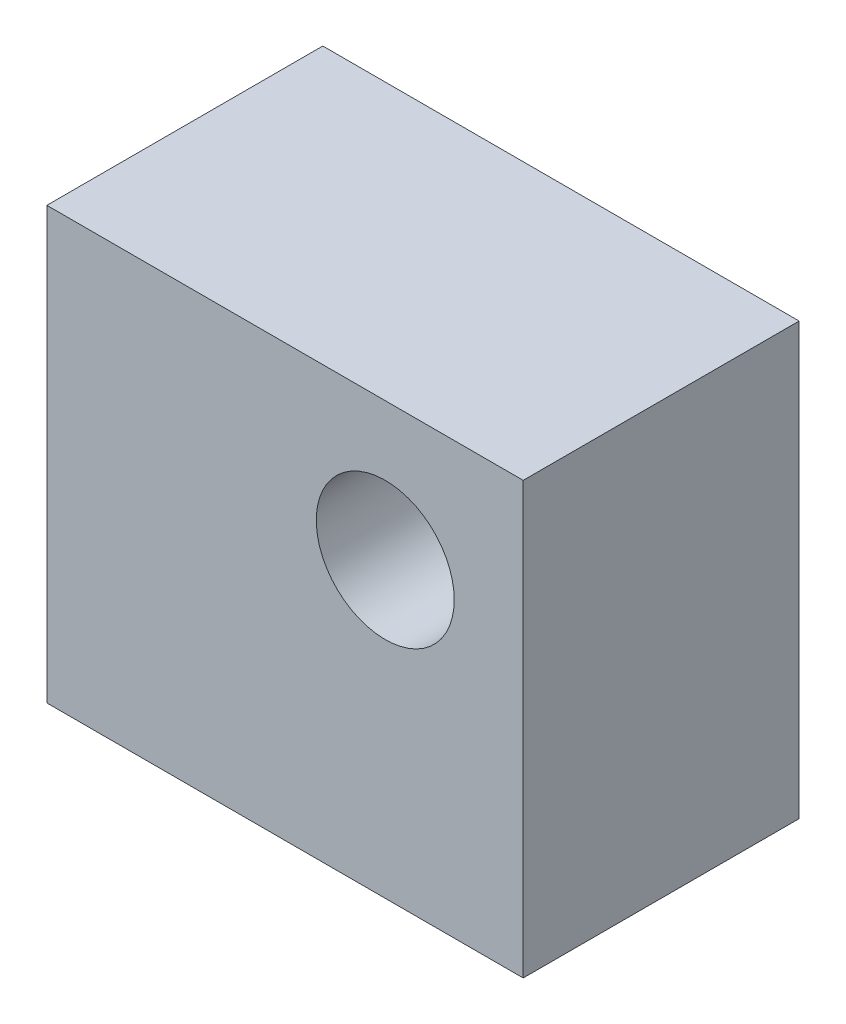
from build123d import *

# Parameters (mm, degrees)
SKETCH3_W                      = 21.924187445
SKETCH3_H                      = 19.837641971
BOSS_EXTRUDE1_DEPTH            = 6.35
SKETCH4_R                      = 3.175
CUT_EXTRUDE1_DEPTH             = 9.525
SKETCH5_R                      = 3.175
CUT_EXTRUDE5_DEPTH             = 9.525
CUT_EXTRUDE5_DIRECTION_2_REACH = 27.174
SKETCH6_R                      = 3.175
CUT_EXTRUDE6_DEPTH             = 9.525


with BuildPart() as part:
    # Sketch3 → Boss-Extrude1 (new, symmetric)
    with BuildSketch(Plane.XY):
        with Locations((10.962093723, -9.918820986)):
            Rectangle(SKETCH3_W, SKETCH3_H)
    extrude(amount=BOSS_EXTRUDE1_DEPTH, both=True)

    # Sketch4 → Cut-Extrude1 (cut)
    with BuildSketch(Plane.ZY):
        with Locations(Location((0, -6.35, 0), (0, 0, 270))):
            Circle(SKETCH4_R)
    extrude(amount=-CUT_EXTRUDE1_DEPTH, mode=Mode.SUBTRACT)

    # Sketch5 → Cut-Extrude5 (cut)
    with BuildSketch(Plane(origin=(7.787093723, -19.837641971, 0), x_dir=(-0.8660254037844382, 0.500000000000001, 0), z_dir=(-0.500000000000001, -0.8660254037844382, 0))):
        with Locations(Location((0, 0, 0), (0, 0, 180))):
            Circle(SKETCH5_R)
    extrude(amount=-CUT_EXTRUDE5_DEPTH, mode=Mode.SUBTRACT)

    # Sketch5 → Cut-Extrude5 direction 2 (cut, up to next)
    with BuildSketch(Plane(origin=(7.787093723, -19.837641971, 0), x_dir=(-0.8660254037844382, 0.500000000000001, 0), z_dir=(-0.500000000000001, -0.8660254037844382, 0)), mode=Mode.PRIVATE) as cut_extrude5_direction_2_sk1:
        with Locations(Location((0, 0, 0), (0, 0, 180))):
            Circle(SKETCH5_R)
    cut_extrude5_direction_2_tool1 = extrude(cut_extrude5_direction_2_sk1.sketch, amount=CUT_EXTRUDE5_DIRECTION_2_REACH, mode=Mode.PRIVATE) & part.part
    add(cut_extrude5_direction_2_tool1.solids().sort_by_distance((7.787094, -19.837642, 0))[0], mode=Mode.SUBTRACT)

    # Sketch6 → Cut-Extrude6 (cut)
    with BuildSketch(Plane(origin=(0, 0, 6.35), x_dir=(-1, 0, 0), z_dir=(0, 0, -1))):
        with Locations(Location((-15.574187445, -6.35, 0), (0, 0, 180))):
            Circle(SKETCH6_R)
    extrude(amount=CUT_EXTRUDE6_DEPTH, mode=Mode.SUBTRACT)


solid = part.part
